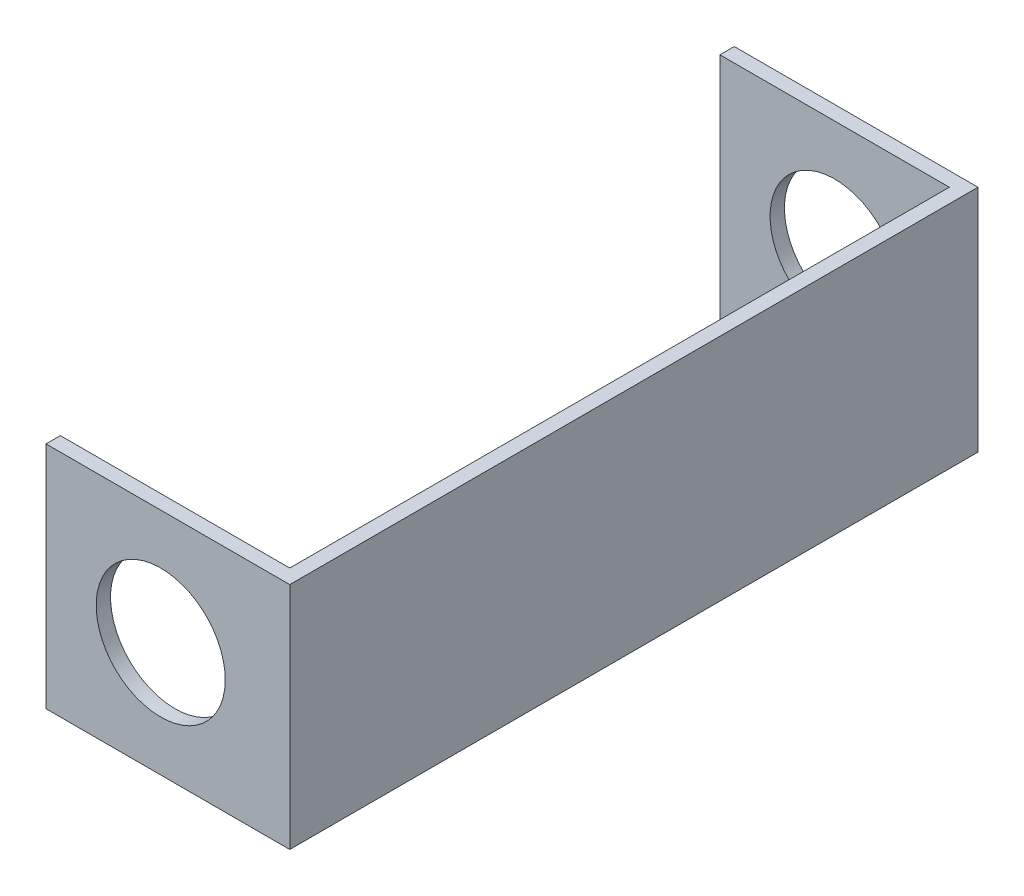
from build123d import *

# Parameters (mm, degrees)
SKETCH1_W           = 53.975
SKETCH1_H           = 50.8
SKETCH1_R           = 14.2875
BOSS_EXTRUDE1_DEPTH = 3.175
SKETCH2_W           = 3.175
SKETCH2_H           = 50.8
BOSS_EXTRUDE2_DEPTH = 146.05
SKETCH3_W           = 3.175
SKETCH3_H           = 50.8
SKETCH3_W_2         = 50.8
SKETCH3_R           = 14.2875
BOSS_EXTRUDE3_DEPTH = 3.175


with BuildPart() as part:
    # Sketch1 → Boss-Extrude1 (new body)
    with BuildSketch(Plane.XY):
        with Locations((26.9875, -25.4)):
            Rectangle(SKETCH1_W, SKETCH1_H)
        with Locations((25.4, -25.4)):
            Circle(SKETCH1_R, mode=Mode.SUBTRACT)
    extrude(amount=BOSS_EXTRUDE1_DEPTH)

    # Sketch2 → Boss-Extrude2 (add)
    with BuildSketch(Plane.XY.offset(3.175)):
        with Locations((52.3875, -25.4)):
            Rectangle(SKETCH2_W, SKETCH2_H)
    extrude(amount=BOSS_EXTRUDE2_DEPTH)

    # Sketch3 → Boss-Extrude3 (add)
    # profile 1 of 2: a face of its own
    with BuildSketch(Plane.XY.offset(149.225)):
        with Locations((52.3875, -25.4)):
            Rectangle(SKETCH3_W, SKETCH3_H)
    # profile 2 of 2: a face of its own
    with BuildSketch(Plane.XY.offset(149.225)):
        with Locations((25.4, -25.4)):
            Rectangle(SKETCH3_W_2, SKETCH3_H)
        with Locations((25.4, -25.4)):
            Circle(SKETCH3_R, mode=Mode.SUBTRACT)
    extrude(amount=BOSS_EXTRUDE3_DEPTH)


solid = part.part
